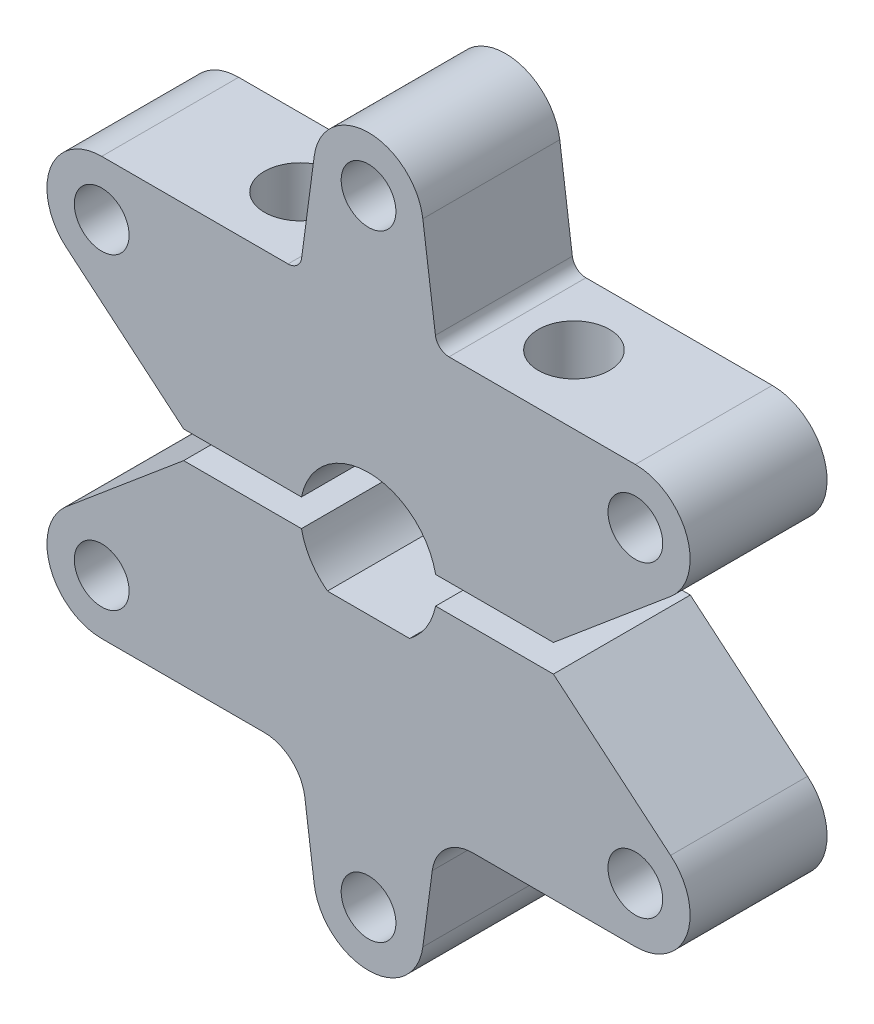
from build123d import *

# Parameters (mm, degrees)
SKETCH_1_R               = 2
EXTRUDE_1_DEPTH          = 10
EXTRUDE_1_2_DEPTH        = 10
CUT_EXTRUDE_2_DEPTH      = 40.772126831
CUT_EXTRUDE_2_DEPTH_BACK = 14.25
SKETCH_3_R               = 2.6
SKETCH_4_R               = 2
CUT_EXTRUDE_3_DEPTH      = 40.772126831
SKETCH_5_R               = 2
EXTRUDE_2_DEPTH          = 10
FILLET_1_R               = 3
FILLET_2_R               = 1


with BuildPart() as part:
    # 草图1 → 凸台-拉伸1 (new body)
    with BuildSketch(Plane.XY):
        with BuildLine():
            Line((-3, -4), (3, -4))
            ThreePointArc((3, -4), (4.224744871, -2.674234614), (4.898979486, -1))
            Line((4.898979486, -1), (13.5, -1))
            Line((13.5, -1), (22.057956933, -8.186858864))
            ThreePointArc((22.057956933, -8.186858864), (23.244066267, -12.618838094), (19.485571585, -15.25))
            Line((19.485571585, -15.25), (-19.485571585, -15.25))
            ThreePointArc((-19.485571585, -15.25), (-23.244066267, -12.618838094), (-22.057956933, -8.186858864))
            Line((-22.057956933, -8.186858864), (-13.5, -1))
            Line((-13.5, -1), (-4.898979486, -1))
            ThreePointArc((-4.898979486, -1), (-4.224744871, -2.674234614), (-3, -4))
        make_face()
        with Locations((19.485571585, -11.25)):
            Circle(SKETCH_1_R, mode=Mode.SUBTRACT)
        with Locations((-19.485571585, -11.25)):
            Circle(SKETCH_1_R, mode=Mode.SUBTRACT)
    extrude(amount=EXTRUDE_1_DEPTH)

    # 草图4 → 切除-拉伸3 (cut, through all)
    with BuildSketch(Plane(origin=(0, 15.25, 0), x_dir=(1, 0, 0), z_dir=(0, 1, 0))):
        with Locations(Location((10, -5, 0), (0, 0, 180))):
            Circle(SKETCH_4_R)
        with Locations(Location((-10, -5, 0), (0, 0, 180))):
            Circle(SKETCH_4_R)
    extrude(amount=-CUT_EXTRUDE_3_DEPTH, mode=Mode.SUBTRACT)



with BuildPart() as body_2:
    # 草图1 → Extrude 1 2 (new body)
    with BuildSketch(Plane.XY):
        with BuildLine():
            Line((-13.5, 1), (-4.898979486, 1))
            ThreePointArc((-4.898979486, 1), (0, 5), (4.898979486, 1))
            Line((4.898979486, 1), (13.5, 1))
            Line((13.5, 1), (22.057956933, 8.186858864))
            ThreePointArc((22.057956933, 8.186858864), (23.244066267, 12.618838094), (19.485571585, 15.25))
            Line((19.485571585, 15.25), (-19.485571585, 15.25))
            ThreePointArc((-19.485571585, 15.25), (-23.244066267, 12.618838094), (-22.057956933, 8.186858864))
            Line((-22.057956933, 8.186858864), (-13.5, 1))
        make_face()
        with Locations((19.485571585, 11.25)):
            Circle(SKETCH_1_R, mode=Mode.SUBTRACT)
        with Locations((-19.485571585, 11.25)):
            Circle(SKETCH_1_R, mode=Mode.SUBTRACT)
    extrude(amount=EXTRUDE_1_2_DEPTH)

    # 草图3 → 切除-拉伸2 (cut, two sides: drawn at the far end of the back side and taken through both)
    with BuildSketch(Plane(origin=(0, 15.25, 0), x_dir=(1, 0, 0), z_dir=(0, 1, 0)).offset(-CUT_EXTRUDE_2_DEPTH_BACK)):
        with Locations((10, -5)):
            Circle(SKETCH_3_R)
        with Locations((-10, -5)):
            Circle(SKETCH_3_R)
    extrude(amount=CUT_EXTRUDE_2_DEPTH + CUT_EXTRUDE_2_DEPTH_BACK, mode=Mode.SUBTRACT)


with BuildPart() as part_1:
    add(part.part)

    add(body_2.part)  # 凸台-拉伸2 merges body 2
    # 草图5 → 凸台-拉伸2 (add)
    # profile 1 of 2: a face of its own
    with BuildSketch(Plane(origin=(0, 0, 0), x_dir=(-1, 0, 0), z_dir=(0, 0, -1))):
        with BuildLine():
            Line((-3.965049412, -23.027620284), (-5, -15.25))
            Line((-5, -15.25), (5, -15.25))
            Line((5, -15.25), (3.965049412, -23.027620284))
            ThreePointArc((3.965049412, -23.027620284), (0, -26.5), (-3.965049412, -23.027620284))
        make_face()
        with Locations((0, -22.5)):
            Circle(SKETCH_5_R, mode=Mode.SUBTRACT)
    # profile 2 of 2: a face of its own
    with BuildSketch(Plane(origin=(0, 0, 0), x_dir=(-1, 0, 0), z_dir=(0, 0, -1))):
        with BuildLine():
            Line((5, 15.25), (3.965049412, 23.027620284))
            ThreePointArc((3.965049412, 23.027620284), (0, 26.5), (-3.965049412, 23.027620284))
            Line((-3.965049412, 23.027620284), (-5, 15.25))
            Line((-5, 15.25), (5, 15.25))
        make_face()
        with Locations((0, 22.5)):
            Circle(SKETCH_5_R, mode=Mode.SUBTRACT)
    extrude(amount=-EXTRUDE_2_DEPTH)

    # 圆角1
    fillet_1_edges = [part_1.edges().sort_by_distance(p)[0] for p in [
        (-5, -15.25, 5),
        (5, -15.25, 5),
    ]]
    fillet(fillet_1_edges, radius=FILLET_1_R)

    # 圆角2
    fillet_2_edges = [part_1.edges().sort_by_distance(p)[0] for p in [
        (5, 15.25, 5),
        (-5, 15.25, 5),
    ]]
    fillet(fillet_2_edges, radius=FILLET_2_R)


solid = part_1.part
